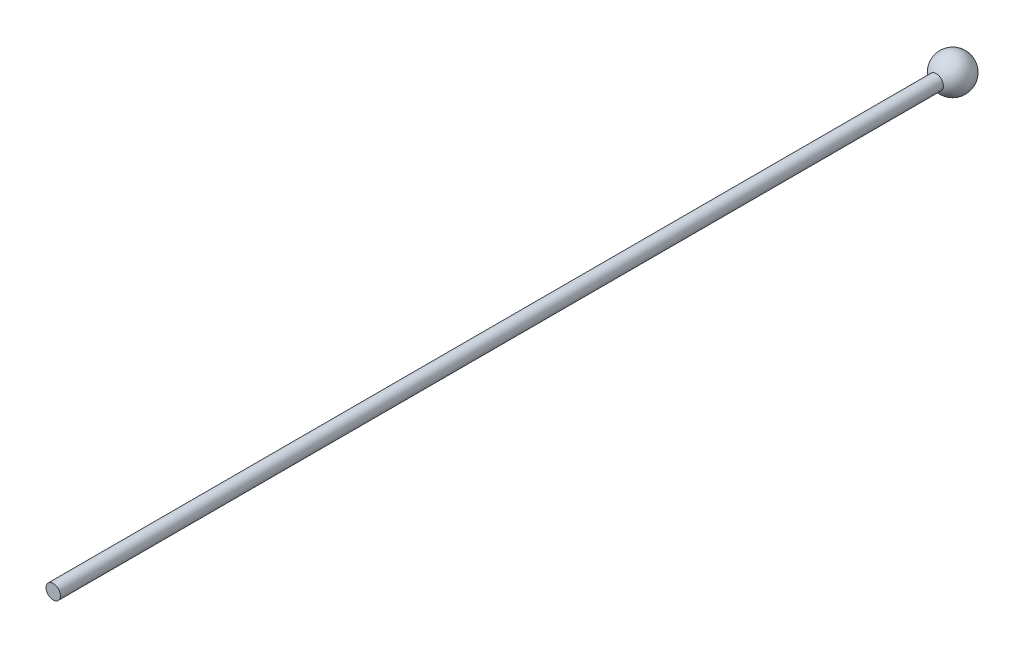
from build123d import *

# Parameters (mm, degrees)
SKETCH3_R           = 4
BOSS_EXTRUDE2_DEPTH = 500


with BuildPart() as part:
    # Sketch1 → Revolve-Thin2 (revolve)
    with BuildSketch(Plane.XY):
        with BuildLine():
            ThreePointArc((10, 0), (0, 10), (-10, 0))
            Line((-10, 0), (-8, 0))
            ThreePointArc((-8, 0), (0, 8), (8, 0))
            Line((8, 0), (10, 0))
        make_face()
    revolve(axis=Axis((-27.497028361, 0, 0), (1, 0, 0)))

    # Sketch3 → Boss-Extrude2 (add)
    with BuildSketch(Plane.XY):
        with Locations(Location((0, 0, 0), (0, 0, 180))):
            Circle(SKETCH3_R)
    extrude(amount=BOSS_EXTRUDE2_DEPTH)


solid = part.part
